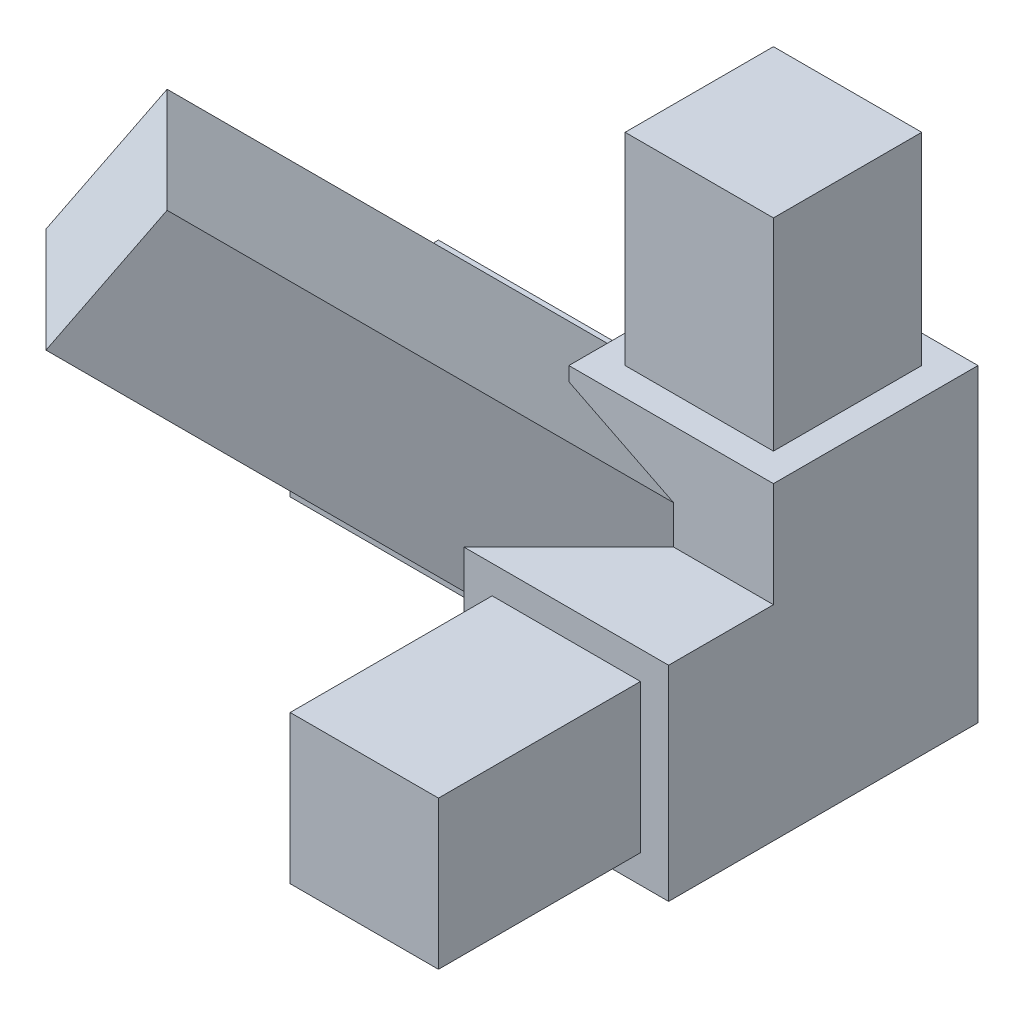
from build123d import *

# Parameters (mm, degrees)
SKETCH1_W                       = 8
SKETCH1_H                       = 8
BOSS_EXTRUDE1_DEPTH             = 4
SKETCH3_W                       = 5.8
SKETCH3_H                       = 5.8
BOSS_EXTRUDE2_DEPTH             = 12
SKETCH5_W                       = 5.8
SKETCH5_H                       = 5.8
BOSS_EXTRUDE3_DEPTH             = 12
SKETCH6_W                       = 5.8
SKETCH6_H                       = 5.8
BOSS_EXTRUDE4_DEPTH             = 12
BOSS_EXTRUDE5_REACH             = 21.514
BOSS_EXTRUDE5_DIRECTION_2_DEPTH = 10
SKETCH9_W                       = 8
SKETCH9_H                       = 8
BOSS_EXTRUDE6_DEPTH             = 4.1
SKETCH10_W                      = 8
SKETCH10_H                      = 8
BOSS_EXTRUDE7_DEPTH             = 4.1
SKETCH11_W                      = 8
SKETCH11_H                      = 8
BOSS_EXTRUDE8_DEPTH             = 4.1


with BuildPart() as part:
    # Sketch1 → Boss-Extrude1 (new, symmetric)
    with BuildSketch(Plane(origin=(0, 0, 0), x_dir=(1, 0, 0), z_dir=(0, 1, 0))):
        Rectangle(SKETCH1_W, SKETCH1_H)
    extrude(amount=BOSS_EXTRUDE1_DEPTH, both=True)

    # Sketch3 → Boss-Extrude2 (add)
    with BuildSketch(Plane.XY.offset(4)):
        Rectangle(SKETCH3_W, SKETCH3_H)
    extrude(amount=BOSS_EXTRUDE2_DEPTH)

    # Sketch5 → Boss-Extrude3 (add)
    with BuildSketch(Plane(origin=(0, 4, 0), x_dir=(1, 0, 0), z_dir=(0, 1, 0))):
        Rectangle(SKETCH5_W, SKETCH5_H)
    extrude(amount=BOSS_EXTRUDE3_DEPTH)

    # Sketch6 → Boss-Extrude4 (add)
    with BuildSketch(Plane.ZY.offset(4)):
        Rectangle(SKETCH6_W, SKETCH6_H)
    extrude(amount=BOSS_EXTRUDE4_DEPTH)

    # Sketch8 → Boss-Extrude5 (add, up to next)
    with BuildSketch(Plane(origin=(-7.266666667, 7.266666667, 7.266666667), x_dir=(-0.8164965809277261, -0.4082482904638631, -0.408248290463863), z_dir=(0.5773502691896257, -0.5773502691896258, -0.5773502691896257)), mode=Mode.PRIVATE) as boss_extrude5_sk1:
        Polygon((1.061473671, 3.961473671), (-3.961473671, 1.061473671), (-1.061473671, -3.961473671), (3.961473671, -1.061473671), align=None)
    boss_extrude5_tool1 = extrude(boss_extrude5_sk1.sketch, amount=BOSS_EXTRUDE5_REACH, mode=Mode.PRIVATE) - part.part
    add(boss_extrude5_tool1.solids().sort_by_distance((-7.266667, 7.266667, 7.266667))[0])

    # Sketch8 → Boss-Extrude5 direction 2 (add)
    with BuildSketch(Plane(origin=(-7.266666667, 7.266666667, 7.266666667), x_dir=(-0.8164965809277261, -0.4082482904638631, -0.408248290463863), z_dir=(0.5773502691896257, -0.5773502691896258, -0.5773502691896257))):
        Polygon((1.061473671, 3.961473671), (-3.961473671, 1.061473671), (-1.061473671, -3.961473671), (3.961473671, -1.061473671), align=None)
    extrude(amount=-BOSS_EXTRUDE5_DIRECTION_2_DEPTH)

    # Sketch9 → Boss-Extrude6 (add)
    with BuildSketch(Plane.ZY.offset(4)):
        Rectangle(SKETCH9_W, SKETCH9_H)
    extrude(amount=BOSS_EXTRUDE6_DEPTH)

    # Sketch10 → Boss-Extrude7 (add)
    with BuildSketch(Plane.XY.offset(4)):
        Rectangle(SKETCH10_W, SKETCH10_H)
    extrude(amount=BOSS_EXTRUDE7_DEPTH)

    # Sketch11 → Boss-Extrude8 (add)
    with BuildSketch(Plane(origin=(0, 4, 0), x_dir=(1, 0, 0), z_dir=(0, 1, 0))):
        Rectangle(SKETCH11_W, SKETCH11_H)
    extrude(amount=BOSS_EXTRUDE8_DEPTH)


solid = part.part
